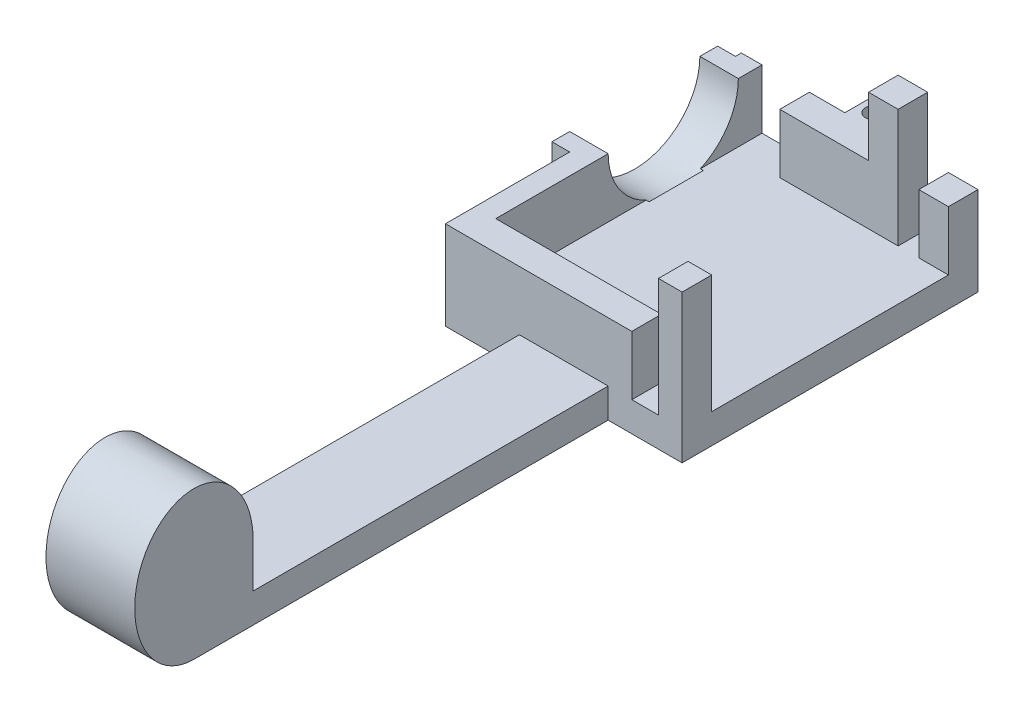
from build123d import *

# Parameters (mm, degrees)
SKETCH1_W            = 40
SKETCH1_H            = 50
BOSS_EXTRUDE1_DEPTH  = 5
SKETCH3_W            = 4
SKETCH3_H            = 5
SKETCH3_W_2          = 5
BOSS_EXTRUDE5_DEPTH  = 20
SKETCH3_3_W          = 15
SKETCH3_3_H          = 5
SKETCH3_3_W_2        = 5
BOSS_EXTRUDE6_DEPTH  = 10
CUT_EXTRUDE3_DEPTH   = 4
BOSS_EXTRUDE9_START  = 3
BOSS_EXTRUDE9_DEPTH  = 3
SKETCH12_W           = 5
SKETCH12_H           = 5
BOSS_EXTRUDE10_DEPTH = 5
SKETCH13_R           = 1.5
CUT_EXTRUDE4_DEPTH   = 5
SKETCH14_W           = 15
SKETCH14_H           = 5
BOSS_EXTRUDE11_DEPTH = 80
SKETCH15_W           = 15
SKETCH15_H           = 20
BOSS_EXTRUDE13_DEPTH = 20
CUT_EXTRUDE5_DEPTH   = 15


with BuildPart() as part:
    # Sketch1 → Boss-Extrude1 (new body)
    with BuildSketch(Plane(origin=(0, 0, 0), x_dir=(1, 0, 0), z_dir=(0, 1, 0))):
        Rectangle(SKETCH1_W, SKETCH1_H)
    extrude(amount=BOSS_EXTRUDE1_DEPTH)

    # Sketch3 → Boss-Extrude5 (add)
    with BuildSketch(Plane(origin=(0, 5, 0), x_dir=(1, 0, 0), z_dir=(0, 1, 0))):
        with Locations((18, -22.5)):
            Rectangle(SKETCH3_W, SKETCH3_H)
        with Locations((9, 22.5)):
            Rectangle(SKETCH3_W_2, SKETCH3_H)
    extrude(amount=BOSS_EXTRUDE5_DEPTH)

    # Sketch3<3> → Boss-Extrude6 (add)
    with BuildSketch(Plane(origin=(0, 5, 0), x_dir=(1, 0, 0), z_dir=(0, 1, 0))):
        with Locations((-1, 22.5)):
            Rectangle(SKETCH3_3_W, SKETCH3_3_H)
        Polygon((-16.5, -20), (-16.5, 25), (-20, 25), (-20, -25), (6.5, -25), (6.5, -20), align=None)
        with Locations((17.5, 22.5)):
            Rectangle(SKETCH3_3_W_2, SKETCH3_3_H)
        with Locations((9, -22.5)):
            Rectangle(SKETCH3_3_W_2, SKETCH3_3_H)
    extrude(amount=BOSS_EXTRUDE6_DEPTH)

    # Sketch8 → Cut-Extrude3 (cut)
    with BuildSketch(Plane.ZY.offset(20)):
        with BuildLine():
            Line((1, 15), (-21, 15))
            ThreePointArc((-21, 15), (-10, 4), (1, 15))
        make_face()
    extrude(amount=-CUT_EXTRUDE3_DEPTH, mode=Mode.SUBTRACT)

    # Sketch10 → Boss-Extrude9 (add)
    with BuildSketch(Plane.ZY.offset(20).offset(BOSS_EXTRUDE9_START)):
        with BuildLine():
            Line((1, 15), (4, 15))
            Line((4, 15), (4, 0))
            Line((4, 0), (-24, 0))
            Line((-24, 0), (-24, 15))
            Line((-24, 15), (-21, 15))
            ThreePointArc((-21, 15), (-10, 4), (1, 15))
        make_face()
    extrude(amount=-BOSS_EXTRUDE9_DEPTH)

    # Sketch12 → Boss-Extrude10 (add)
    with BuildSketch(Plane(origin=(0, 0, -25), x_dir=(-1, 0, 0), z_dir=(0, 0, -1))):
        with Locations((0, 12.5)):
            Rectangle(SKETCH12_W, SKETCH12_H)
    extrude(amount=BOSS_EXTRUDE10_DEPTH)

    # Sketch13 → Cut-Extrude4 (cut)
    with BuildSketch(Plane.XZ.offset(-10)):
        with Locations(Location((0, -27.5, 0), (0, 0, 270))):
            Circle(SKETCH13_R)
    extrude(amount=-CUT_EXTRUDE4_DEPTH, mode=Mode.SUBTRACT)

    # Sketch14 → Boss-Extrude11 (add)
    with BuildSketch(Plane.XY.offset(25)):
        with Locations((0, 2.5)):
            Rectangle(SKETCH14_W, SKETCH14_H)
    extrude(amount=BOSS_EXTRUDE11_DEPTH)

    # Sketch15 → Boss-Extrude13 (add)
    with BuildSketch(Plane(origin=(0, 5, 0), x_dir=(1, 0, 0), z_dir=(0, 1, 0))):
        with Locations((0, -95)):
            Rectangle(SKETCH15_W, SKETCH15_H)
    extrude(amount=BOSS_EXTRUDE13_DEPTH)

    # Sketch16 → Cut-Extrude5 (cut)
    with BuildSketch(Plane.ZY.offset(7.5)):
        with BuildLine():
            Line((85, 12.5), (85, 25))
            Line((85, 25), (95, 25))
            Line((95, 25), (105, 25))
            Line((105, 25), (105, 0))
            Line((105, 0), (95, 0))
            add(Edge.make_bspline(
                [(95, 0), (119.142136, 0), (102.071068, 21.338835), (85, 42.67767), (85, 12.5)],
                knots=[3.141593, 3.141593, 3.141593, 5.497787, 5.497787, 7.853982, 7.853982, 7.853982], degree=2, weights=[1, 0.382683, 1, 0.382683, 1]))
        make_face()
    extrude(amount=-CUT_EXTRUDE5_DEPTH, mode=Mode.SUBTRACT)


solid = part.part
